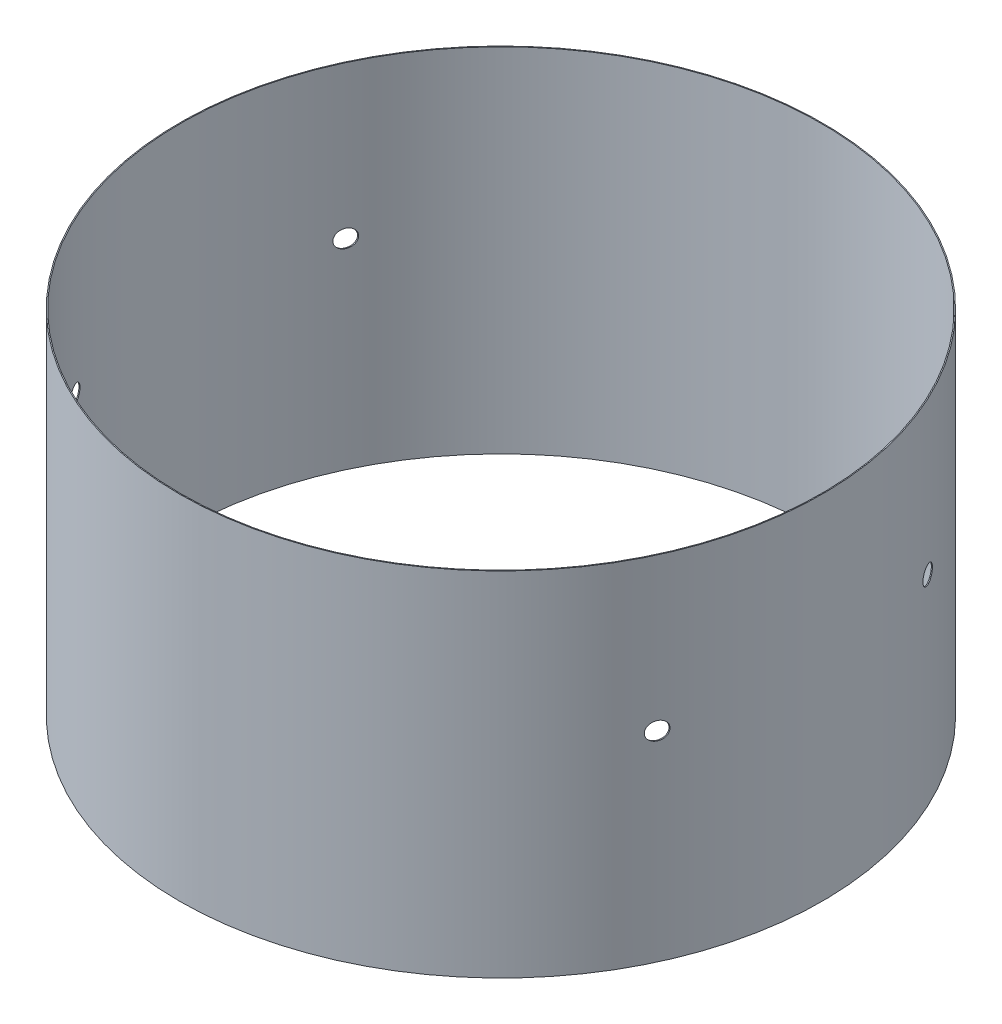
from build123d import *

# Parameters (mm, degrees)
SKETCH1_R               = 501.5
SKETCH1_R_2             = 500
BOSS_EXTRUDE1_DEPTH     = 550
CUT_EXTRUDE2_DEPTH      = 898.499025069
CUT_EXTRUDE2_DEPTH_BACK = 898.499025069
SKETCH2_R               = 13.75


with BuildPart() as part:
    # Sketch1 → Boss-Extrude1 (new body)
    with BuildSketch(Plane(origin=(0, 0, 0), x_dir=(1, 0, 0), z_dir=(0, 1, 0))):
        with Locations(Location((0, 0, 0), (0, 0, 270))):
            Circle(SKETCH1_R)
        with Locations(Location((0, 0, 0), (0, 0, 270))):
            Circle(SKETCH1_R_2, mode=Mode.SUBTRACT)
    extrude(amount=BOSS_EXTRUDE1_DEPTH)

    # Sketch2 → Cut-Extrude2 (cut, two sides: drawn at the far end of the back side and taken through both)
    with BuildSketch(Plane(origin=(0, 0, 0), x_dir=(0, 0, -1), z_dir=(1, 0, 0)).offset(-CUT_EXTRUDE2_DEPTH_BACK)):
        with Locations((211, 312.5)):
            Circle(SKETCH2_R)
        with Locations((-211, 312.5)):
            Circle(SKETCH2_R)
    extrude(amount=CUT_EXTRUDE2_DEPTH + CUT_EXTRUDE2_DEPTH_BACK, mode=Mode.SUBTRACT)


solid = part.part
